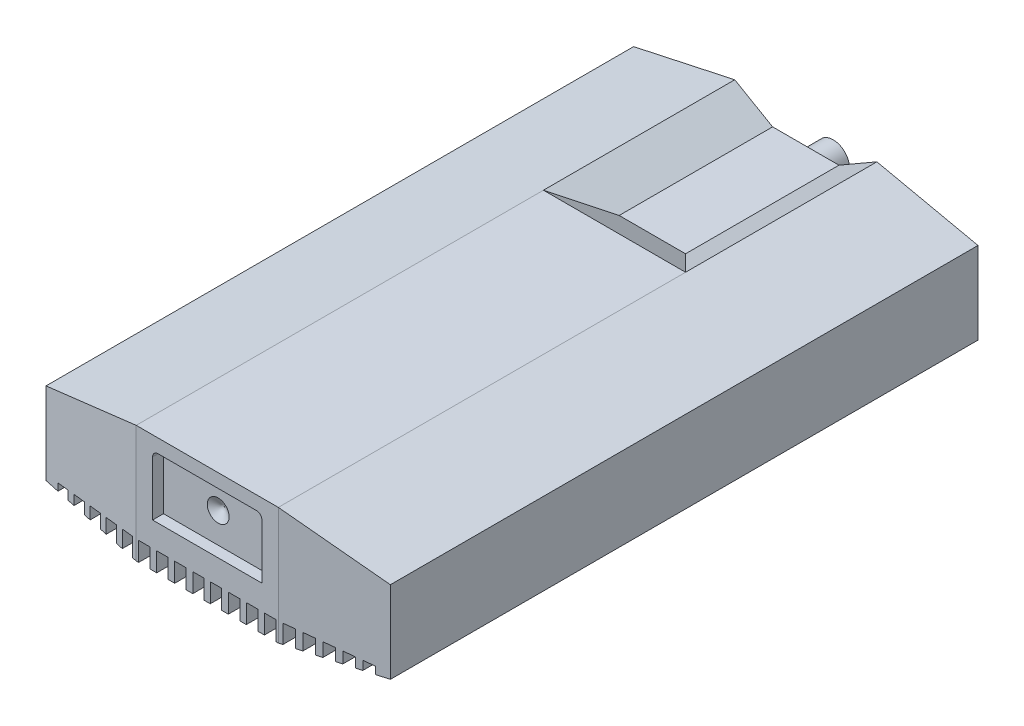
from build123d import *

# Parameters (mm, degrees)
EXTRUDE_1_DEPTH        = 109.5
SKETCH_2_W             = 26
SKETCH_2_H             = 50
CUT_EXTRUDE_1_DEPTH    = 4
CUT_EXTRUDE_1_DRAFT    = -60
CUT_EXTRUDE_2_DEPTH    = 127.786483901
CUT_EXTRUDE_3_DEPTH    = 116.951498481
CUT_EXTRUDE_4_DEPTH    = 2
SKETCH_7_W             = 6.8
SKETCH_7_H             = 4
EXTRUDE_2_DEPTH        = 3.5
HOLE_WIZARD_M2_1_D     = 1.6
HOLE_WIZARD_M2_1_DEPTH = 5.2
HOLE_WIZARD_M2_1_TIP   = 0.480688495
SKETCH_11_R            = 3
EXTRUDE_3_DEPTH        = 10


with BuildPart() as part:
    # 草图1 → 凸台-拉伸1 (new body)
    with BuildSketch(Plane.XY):
        Polygon((31.5, 6.75), (31.5, -8.25), (29.05, -8.581081081), (29.05, -7.25), (26.95, -7.25), (26.95, -8.864864865), (25.75, -9.027027027), (25.75, -7.25), (23.65, -7.25), (23.65, -9.310810811), (22.45, -9.472972973), (22.45, -7.25), (20.35, -7.25), (20.35, -9.756756757), (19.15, -9.918918919), (19.15, -7.25), (17.05, -7.25), (17.05, -10.202702703), (15.85, -10.364864865), (15.85, -7.25), (13.75, -7.25), (13.75, -10.648648649), (13, -10.75), (12.55, -10.75), (12.55, -7.25), (10.45, -7.25), (10.45, -10.75), (9.25, -10.75), (9.25, -7.25), (7.15, -7.25), (7.15, -10.75), (5.95, -10.75), (5.95, -7.25), (3.85, -7.25), (3.85, -10.75), (2.65, -10.75), (2.65, -7.25), (0.55, -7.25), (0.55, -10.75), (-0.55, -10.75), (-0.55, -7.25), (-2.65, -7.25), (-2.65, -10.75), (-3.85, -10.75), (-3.85, -7.25), (-5.95, -7.25), (-5.95, -10.75), (-7.15, -10.75), (-7.15, -7.25), (-9.25, -7.25), (-9.25, -10.75), (-10.45, -10.75), (-10.45, -7.25), (-12.55, -7.25), (-12.55, -10.75), (-13, -10.75), (-13.75, -10.648648649), (-13.75, -7.25), (-15.85, -7.25), (-15.85, -10.364864865), (-17.05, -10.202702703), (-17.05, -7.25), (-19.15, -7.25), (-19.15, -9.918918919), (-20.35, -9.756756757), (-20.35, -7.25), (-22.45, -7.25), (-22.45, -9.472972973), (-23.65, -9.310810811), (-23.65, -7.25), (-25.75, -7.25), (-25.75, -9.027027027), (-26.95, -8.864864865), (-26.95, -7.25), (-29.05, -7.25), (-29.05, -8.581081081), (-31.5, -8.25), (-31.5, 6.75), (-13, 10.75), (13, 10.75), align=None)
    extrude(amount=EXTRUDE_1_DEPTH)


with BuildPart() as cut_extrude_1_tool:
    # 草图2 → 切除-拉伸1 (with draft: the straight prism first)
    with BuildSketch(Plane(origin=(0, 10.75, 0), x_dir=(1, 0, 0), z_dir=(0, 1, 0))):
        with Locations((0, -10)):
            Rectangle(SKETCH_2_W, SKETCH_2_H)
    extrude(amount=-CUT_EXTRUDE_1_DEPTH)
    # 切除-拉伸1: the draft: its side faces are tilted about the plane it starts from
    cut_extrude_1_sides = [cut_extrude_1_tool.faces().sort_by_distance(p)[0] for p in [
        (-13, 8.75, 10),
        (0, 8.75, 35),
        (13, 8.75, 10),
        (0, 8.75, -15),
    ]]
    draft(cut_extrude_1_sides, Plane(origin=(0, 10.75, 0), x_dir=(1, 0, 0), z_dir=(0, 1, 0)), CUT_EXTRUDE_1_DRAFT)


with BuildPart() as part_1:
    add(part.part)

    # 切除-拉伸1: cut by cut_extrude_1_tool
    add(cut_extrude_1_tool.part, mode=Mode.SUBTRACT)

    # 草图3 → 切除-拉伸2 (cut, through all)
    with BuildSketch(Plane(origin=(31.5, 0, 0), x_dir=(0, 0, -1), z_dir=(1, 0, 0))):
        Polygon((0, -8.25), (-2.5, -10.75), (0, -10.75), align=None)
    extrude(amount=-CUT_EXTRUDE_2_DEPTH, mode=Mode.SUBTRACT)

    # 草图4 → 切除-拉伸3 (cut, through all)
    with BuildSketch(Plane(origin=(0, 10.75, 0), x_dir=(1, 0, 0), z_dir=(0, 1, 0))):
        Polygon((13, -109.5), (31.5, -107.5), (31.5, -109.5), align=None)
        Polygon((-31.5, -107.5), (-31.5, -109.5), (-13, -109.5), align=None)
    extrude(amount=-CUT_EXTRUDE_3_DEPTH, mode=Mode.SUBTRACT)

    # 草图5 → 切除-拉伸4 (cut)
    with BuildSketch(Plane.XY.offset(109.5)):
        with BuildLine():
            Line((-9, 8.25), (9, 8.25))
            ThreePointArc((9, 8.25), (9.707106781, 7.957106781), (10, 7.25))
            Line((10, 7.25), (10, -2.75))
            Line((10, -2.75), (-10, -2.75))
            Line((-10, -2.75), (-10, 7.25))
            ThreePointArc((-10, 7.25), (-9.707106781, 7.957106781), (-9, 8.25))
        make_face()
    extrude(amount=-CUT_EXTRUDE_4_DEPTH, mode=Mode.SUBTRACT)

    # 切除-拉伸5 cone 1 section (through the dimple's axis) → 切除-拉伸5 (revolve, cut)
    with BuildSketch(Plane(origin=(0, 2.75, 107.5), x_dir=(0, -1, 0), z_dir=(1, 0, 0))):
        Polygon((0, 0), (2, 0), (0, 1.154700538), align=None)
    revolve(axis=Axis((0, 2.75, 107.5), (0, 0, -1)), mode=Mode.SUBTRACT)

    # 草图7 → 凸台-拉伸2 (add)
    with BuildSketch(Plane.XZ.offset(10.75)):
        with Locations((-7, 84.5)):
            Rectangle(SKETCH_7_W, SKETCH_7_H)
        with Locations((7, 84.5)):
            Rectangle(SKETCH_7_W, SKETCH_7_H)
        with Locations((7, 4.5)):
            Rectangle(SKETCH_7_W, SKETCH_7_H)
        with Locations((-7, 4.5)):
            Rectangle(SKETCH_7_W, SKETCH_7_H)
    extrude(amount=-EXTRUDE_2_DEPTH)

    # M2 螺纹孔1
    with Locations(Plane(origin=(0, -10.75, 0), x_dir=(-1, 0, 0), z_dir=(0, -1, 0))):
        with Locations((7, -4.5), (-7, -4.5), (7, -84.5), (-7, -84.5)):
            Hole(HOLE_WIZARD_M2_1_D / 2, depth=HOLE_WIZARD_M2_1_DEPTH)
            with Locations((0, 0, -(HOLE_WIZARD_M2_1_DEPTH + HOLE_WIZARD_M2_1_TIP / 2))):  # 118° drill point
                Cone(0, HOLE_WIZARD_M2_1_D / 2, HOLE_WIZARD_M2_1_TIP, mode=Mode.SUBTRACT)

    # 草图11 → 凸台-拉伸3 (add)
    with BuildSketch(Plane(origin=(0, 0, 0), x_dir=(-1, 0, 0), z_dir=(0, 0, -1))):
        with Locations((5, -2.75)):
            Circle(SKETCH_11_R)
        with Locations((-5, -2.75)):
            Circle(SKETCH_11_R)
    extrude(amount=EXTRUDE_3_DEPTH)


solid = part_1.part
